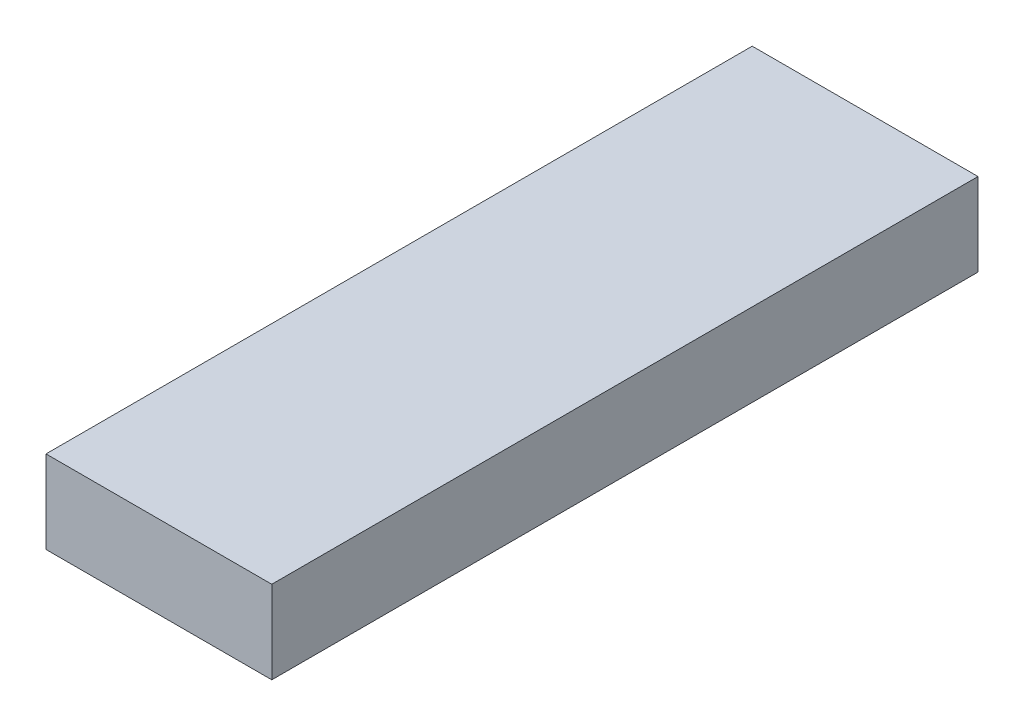
from build123d import *

# Parameters (mm, degrees)
SKETCH1_W           = 381
SKETCH1_H           = 1191.768
BOSS_EXTRUDE1_DEPTH = 139.7


with BuildPart() as part:
    # Sketch1 → Boss-Extrude1 (new body)
    with BuildSketch(Plane(origin=(0, 0, 0), x_dir=(1, 0, 0), z_dir=(0, 1, 0))):
        with Locations((190.5, 595.884)):
            Rectangle(SKETCH1_W, SKETCH1_H)
    extrude(amount=BOSS_EXTRUDE1_DEPTH)


solid = part.part
